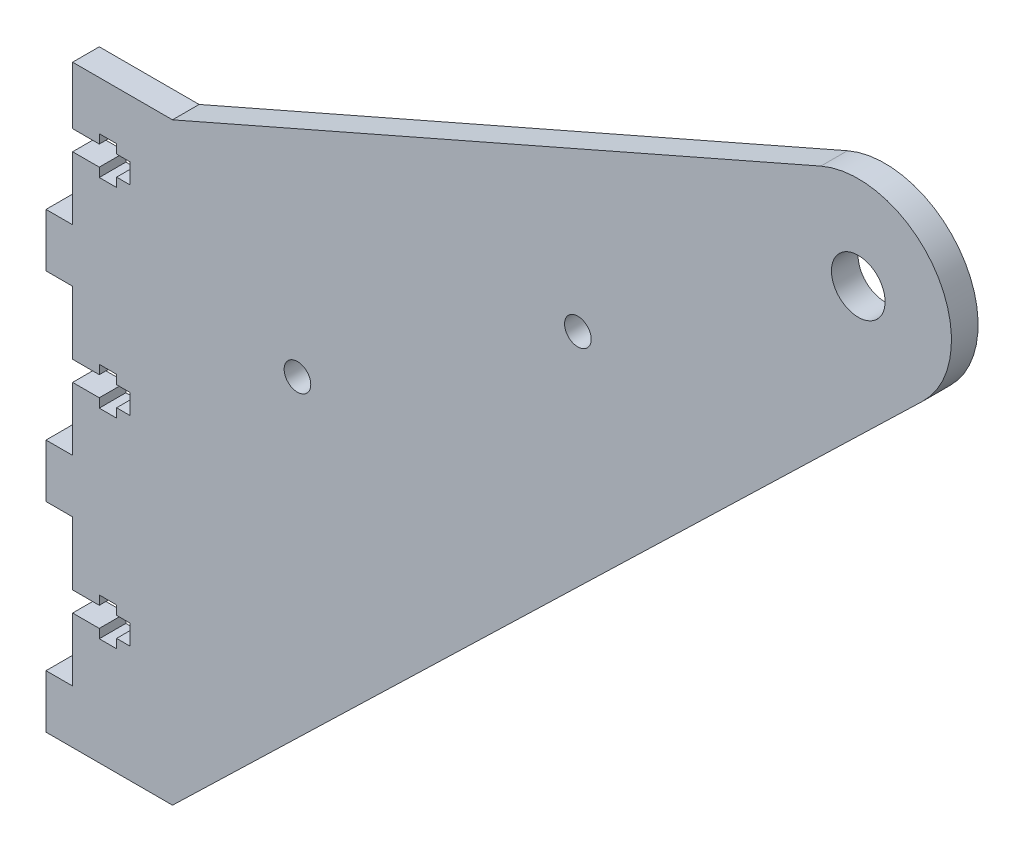
from build123d import *

# Parameters (mm, degrees)
SKETCH_1_R      = 2
SKETCH_1_R_2    = 4.03
EXTRUDE_1_DEPTH = 4


with BuildPart() as part:
    # 草图1 → 凸台-拉伸1 (new body)
    with BuildSketch(Plane.XY):
        with BuildLine():
            Line((2.282857143, -22.113571429), (-1.717142857, -22.113571429))
            Line((-1.717142857, -22.113571429), (-1.717142857, -31.613571429))
            Line((-1.717142857, -31.613571429), (-5.717142857, -31.613571429))
            Line((-5.717142857, -31.613571429), (-5.717142857, -39.613571429))
            Line((-5.717142857, -39.613571429), (-1.717142857, -39.613571429))
            Line((-1.717142857, -39.613571429), (13.282857143, -39.613571429))
            Line((13.282857143, -39.613571429), (126.011390324, 69.318874641))
            ThreePointArc((126.011390324, 69.318874641), (127.911107543, 87.182824703), (110.66398275, 92.20938652))
            Line((110.66398275, 92.20938652), (13.282857143, 49.538084372))
            Line((13.282857143, 49.538084372), (-1.717142857, 49.538084372))
            Line((-1.717142857, 49.538084372), (-1.717142857, 40.886428571))
            Line((-1.717142857, 40.886428571), (2.282857143, 40.886428571))
            Line((2.282857143, 40.886428571), (2.282857143, 42.236428571))
            Line((2.282857143, 42.236428571), (4.882857143, 42.236428571))
            Line((4.882857143, 42.236428571), (4.882857143, 40.886428571))
            Line((4.882857143, 40.886428571), (6.882857143, 40.886428571))
            Line((6.882857143, 40.886428571), (6.882857143, 37.886428571))
            Line((6.882857143, 37.886428571), (4.882857143, 37.886428571))
            Line((4.882857143, 37.886428571), (4.882857143, 36.536428571))
            Line((4.882857143, 36.536428571), (2.282857143, 36.536428571))
            Line((2.282857143, 36.536428571), (2.282857143, 37.886428571))
            Line((2.282857143, 37.886428571), (-1.717142857, 37.886428571))
            Line((-1.717142857, 37.886428571), (-1.717142857, 28.386428571))
            Line((-1.717142857, 28.386428571), (-5.717142857, 28.386428571))
            Line((-5.717142857, 28.386428571), (-5.717142857, 20.386428571))
            Line((-5.717142857, 20.386428571), (-1.717142857, 20.386428571))
            Line((-1.717142857, 20.386428571), (-1.717142857, 10.886428571))
            Line((-1.717142857, 10.886428571), (2.282857143, 10.886428571))
            Line((2.282857143, 10.886428571), (2.282857143, 12.236428571))
            Line((2.282857143, 12.236428571), (4.882857143, 12.236428571))
            Line((4.882857143, 12.236428571), (4.882857143, 10.886428571))
            Line((4.882857143, 10.886428571), (6.882857143, 10.886428571))
            Line((6.882857143, 10.886428571), (6.882857143, 7.886428571))
            Line((6.882857143, 7.886428571), (4.882857143, 7.886428571))
            Line((4.882857143, 7.886428571), (4.882857143, 6.536428571))
            Line((4.882857143, 6.536428571), (2.282857143, 6.536428571))
            Line((2.282857143, 6.536428571), (2.282857143, 7.886428571))
            Line((2.282857143, 7.886428571), (-1.717142857, 7.886428571))
            Line((-1.717142857, 7.886428571), (-1.717142857, -1.613571429))
            Line((-1.717142857, -1.613571429), (-5.717142857, -1.613571429))
            Line((-5.717142857, -1.613571429), (-5.717142857, -9.613571429))
            Line((-5.717142857, -9.613571429), (-1.717142857, -9.613571429))
            Line((-1.717142857, -9.613571429), (-1.717142857, -19.113571429))
            Line((-1.717142857, -19.113571429), (2.282857143, -19.113571429))
            Line((2.282857143, -19.113571429), (2.282857143, -17.763571429))
            Line((2.282857143, -17.763571429), (4.882857143, -17.763571429))
            Line((4.882857143, -17.763571429), (4.882857143, -19.113571429))
            Line((4.882857143, -19.113571429), (6.882857143, -19.113571429))
            Line((6.882857143, -19.113571429), (6.882857143, -22.113571429))
            Line((6.882857143, -22.113571429), (4.882857143, -22.113571429))
            Line((4.882857143, -22.113571429), (4.882857143, -23.463571429))
            Line((4.882857143, -23.463571429), (2.282857143, -23.463571429))
            Line((2.282857143, -23.463571429), (2.282857143, -22.113571429))
        make_face()
        with Locations((32.050124236, 25.489798741)):
            Circle(SKETCH_1_R, mode=Mode.SUBTRACT)
        with Locations((74.16649069, 52.438113656)):
            Circle(SKETCH_1_R, mode=Mode.SUBTRACT)
        with Locations((116.282857143, 79.386428571)):
            Circle(SKETCH_1_R_2, mode=Mode.SUBTRACT)
    extrude(amount=EXTRUDE_1_DEPTH)


solid = part.part
